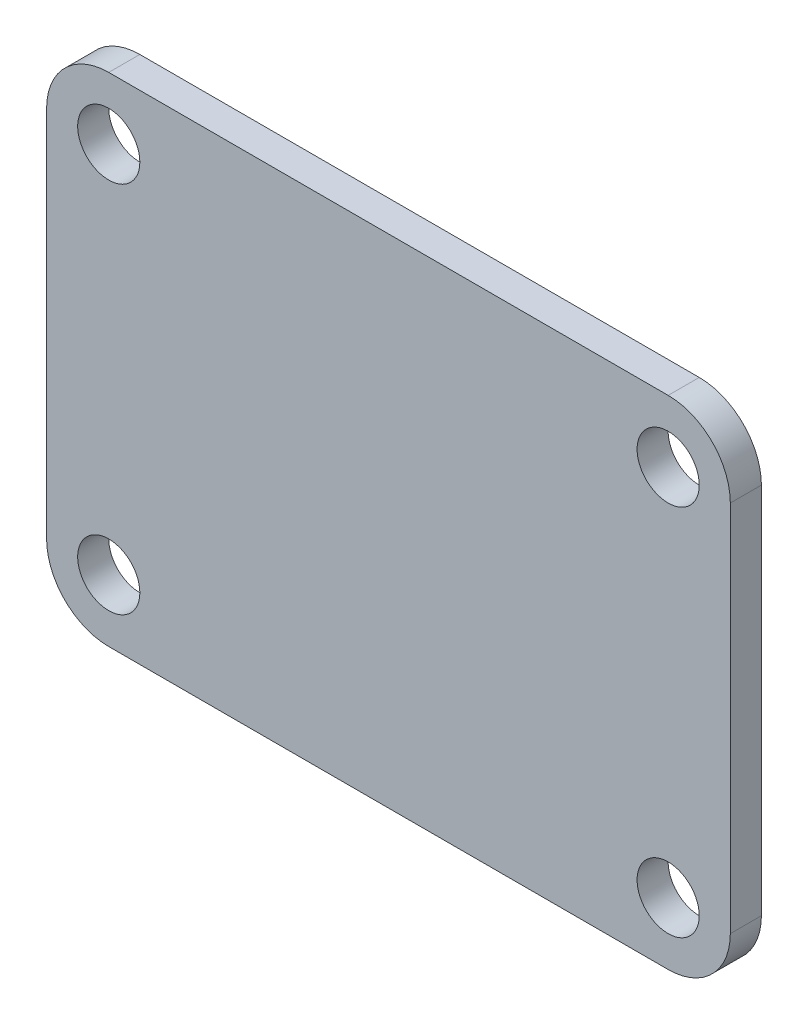
from build123d import *

# Parameters (mm, degrees)
SKETCH1_W           = 27.94
SKETCH1_H           = 20.32
SKETCH1_R           = 1.27
BOSS_EXTRUDE1_DEPTH = 1.27
FILLET1_R           = 2.54


with BuildPart() as part:
    # Sketch1 → Boss-Extrude1 (new body)
    with BuildSketch(Plane.XY):
        with Locations((11.43, 7.62)):
            Rectangle(SKETCH1_W, SKETCH1_H)
        with Locations((0, 15.24)):
            Circle(SKETCH1_R, mode=Mode.SUBTRACT)
        Circle(SKETCH1_R, mode=Mode.SUBTRACT)
        with Locations((22.86, 15.24)):
            Circle(SKETCH1_R, mode=Mode.SUBTRACT)
        with Locations((22.86, 0)):
            Circle(SKETCH1_R, mode=Mode.SUBTRACT)
    extrude(amount=BOSS_EXTRUDE1_DEPTH)

    # Fillet1
    fillet1_edges = [part.edges().sort_by_distance(p)[0] for p in [
        (25.4, 17.78, 0.635),
        (25.4, -2.54, 0.635),
        (-2.54, -2.54, 0.635),
        (-2.54, 17.78, 0.635),
    ]]
    fillet(fillet1_edges, radius=FILLET1_R)


solid = part.part
